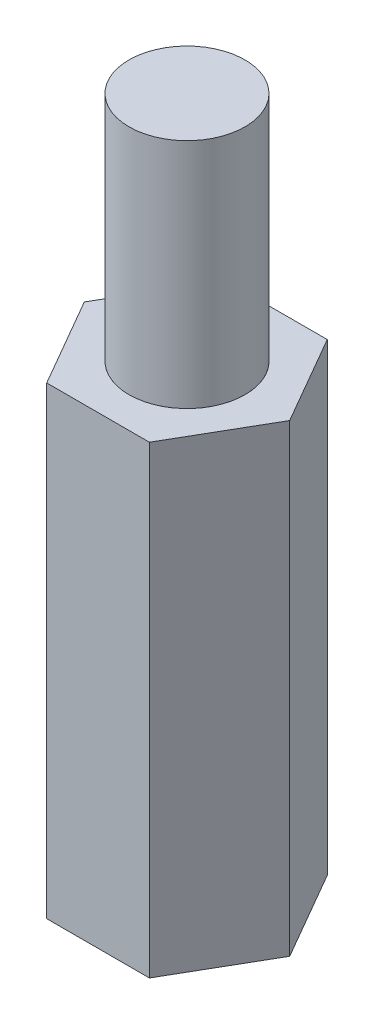
from build123d import *

# Parameters (mm, degrees)
EXTRUDE_1_DEPTH     = 12
SKETCH_3_R          = 1.5
EXTRUDE_2_DEPTH     = 6
SKETCH_4_R          = 1.5
CUT_EXTRUDE_1_DEPTH = 12


with BuildPart() as part:
    # 草图1 → 凸台-拉伸1 (new body)
    with BuildSketch(Plane(origin=(0, 0, 0), x_dir=(1, 0, 0), z_dir=(0, 1, 0))):
        Polygon((-1.327905619, 2.3), (-2.655811238, 0), (-1.327905619, -2.3), (1.327905619, -2.3), (2.655811238, 0), (1.327905619, 2.3), align=None)
    extrude(amount=EXTRUDE_1_DEPTH)

    # 草图3 → 凸台-拉伸2 (add)
    with BuildSketch(Plane(origin=(0, 12, 0), x_dir=(1, 0, 0), z_dir=(0, 1, 0))):
        with Locations(Location((0, 0, 0), (0, 0, 270))):
            Circle(SKETCH_3_R)
    extrude(amount=EXTRUDE_2_DEPTH)

    # 草图4 → 切除-拉伸1 (cut)
    with BuildSketch(Plane.XZ):
        with Locations(Location((0, 0, 0), (0, 0, 270))):
            Circle(SKETCH_4_R)
    extrude(amount=-CUT_EXTRUDE_1_DEPTH, mode=Mode.SUBTRACT)


with BuildPart() as cut_extrude_1_piece_1:
    # of the separate pieces the step leaves, piece 1, a body of its own (cut_extrude_1_pieces)
    add(part.part.solids().sort_by_distance((-1.327905619, 0, -2.3))[0])


with BuildPart() as cut_extrude_1_piece_2:
    # of the separate pieces the step leaves, piece 2, a body of its own (cut_extrude_1_pieces)
    add(part.part.solids().sort_by_distance((0, 18, 1.5))[0])


solid = Compound([cut_extrude_1_piece_1.part, cut_extrude_1_piece_2.part])
